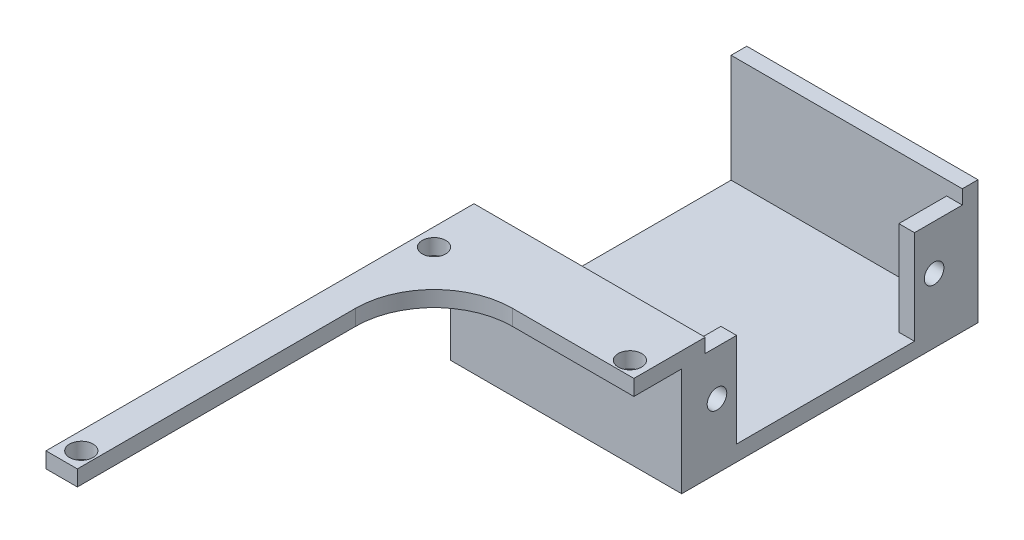
from build123d import *

# Parameters (mm, degrees)
BOSS_EXTRUDE1_DEPTH = 2
FILLET1_R           = 10
SKETCH2_R           = 1.5
CUT_EXTRUDE1_DEPTH  = 53.603569832
SKETCH3_W           = 29.5
SKETCH3_H           = 2
BOSS_EXTRUDE2_DEPTH = 5.1
SKETCH4_W           = 29.5
SKETCH4_H           = 3
BOSS_EXTRUDE3_DEPTH = 13.8
SKETCH5_W           = 29.5
SKETCH5_H           = 2
BOSS_EXTRUDE5_DEPTH = 34.8
SKETCH7_W           = 29.5
SKETCH7_H           = 2
BOSS_EXTRUDE6_DEPTH = 13.8
SKETCH8_W           = 2
SKETCH8_H           = 4
SKETCH8_H_2         = 6.1
BOSS_EXTRUDE7_DEPTH = 12
SKETCH9_2_R         = 1.25
CUT_EXTRUDE3_DEPTH  = 12


with BuildPart() as part:
    # Sketch1 → Boss-Extrude1 (new body)
    with BuildSketch(Plane(origin=(0, 0, 0), x_dir=(1, 0, 0), z_dir=(0, 1, 0))):
        Polygon((-41.234375, 16.8984375), (-41.234375, -32.6015625), (-37.234375, -32.6015625), (-37.234375, 12.8984375), (-11.734375, 12.8984375), (-11.734375, 16.8984375), align=None)
    extrude(amount=BOSS_EXTRUDE1_DEPTH)

    # Fillet1
    fillet1_edges = [part.edges().sort_by_distance(p)[0] for p in [
        (-37.234375, 1, -12.8984375),
    ]]
    fillet(fillet1_edges, radius=FILLET1_R)

    # Sketch2 → Cut-Extrude1 (cut, through all)
    with BuildSketch(Plane(origin=(0, 2, 0), x_dir=(1, 0, 0), z_dir=(0, 1, 0))):
        with Locations((-38.984375, -30.3515625)):
            Circle(SKETCH2_R)
        with Locations((-38.984375, 14.6484375)):
            Circle(SKETCH2_R)
        with Locations((-13.984375, 14.6484375)):
            Circle(SKETCH2_R)
    extrude(amount=-CUT_EXTRUDE1_DEPTH, mode=Mode.SUBTRACT)

    # Sketch3 → Boss-Extrude2 (add)
    with BuildSketch(Plane(origin=(0, 0, -16.8984375), x_dir=(-1, 0, 0), z_dir=(0, 0, -1))):
        with Locations((26.484375, 1)):
            Rectangle(SKETCH3_W, SKETCH3_H)
    extrude(amount=BOSS_EXTRUDE2_DEPTH)

    # Sketch4 → Boss-Extrude3 (add)
    with BuildSketch(Plane.XZ):
        with Locations((-26.484375, -20.4984375)):
            Rectangle(SKETCH4_W, SKETCH4_H)
    extrude(amount=BOSS_EXTRUDE3_DEPTH)

    # Sketch5 → Boss-Extrude5 (add)
    with BuildSketch(Plane(origin=(0, 0, -21.9984375), x_dir=(-1, 0, 0), z_dir=(0, 0, -1))):
        with Locations((26.484375, -12.8)):
            Rectangle(SKETCH5_W, SKETCH5_H)
    extrude(amount=BOSS_EXTRUDE5_DEPTH)

    # Sketch7 → Boss-Extrude6 (add)
    with BuildSketch(Plane(origin=(0, -11.8, 0), x_dir=(1, 0, 0), z_dir=(0, 1, 0))):
        with Locations((-26.484375, 55.7984375)):
            Rectangle(SKETCH7_W, SKETCH7_H)
    extrude(amount=BOSS_EXTRUDE6_DEPTH)

    # Sketch8 → Boss-Extrude7 (add)
    with BuildSketch(Plane(origin=(0, -11.8, 0), x_dir=(1, 0, 0), z_dir=(0, 1, 0))):
        with Locations((-12.734375, 23.9984375)):
            Rectangle(SKETCH8_W, SKETCH8_H)
        with Locations((-12.734375, 51.7484375)):
            Rectangle(SKETCH8_W, SKETCH8_H_2)
    extrude(amount=BOSS_EXTRUDE7_DEPTH)

    # Sketch9<2> → Cut-Extrude3 (cut)
    with BuildSketch(Plane(origin=(-11.734375, 0, 0), x_dir=(0, 0, -1), z_dir=(1, 0, 0))):
        with Locations((23.4984375, -5.55)):
            Circle(SKETCH9_2_R)
        with Locations((51.1984375, -5.55)):
            Circle(SKETCH9_2_R)
    extrude(amount=-CUT_EXTRUDE3_DEPTH, mode=Mode.SUBTRACT)


solid = part.part
